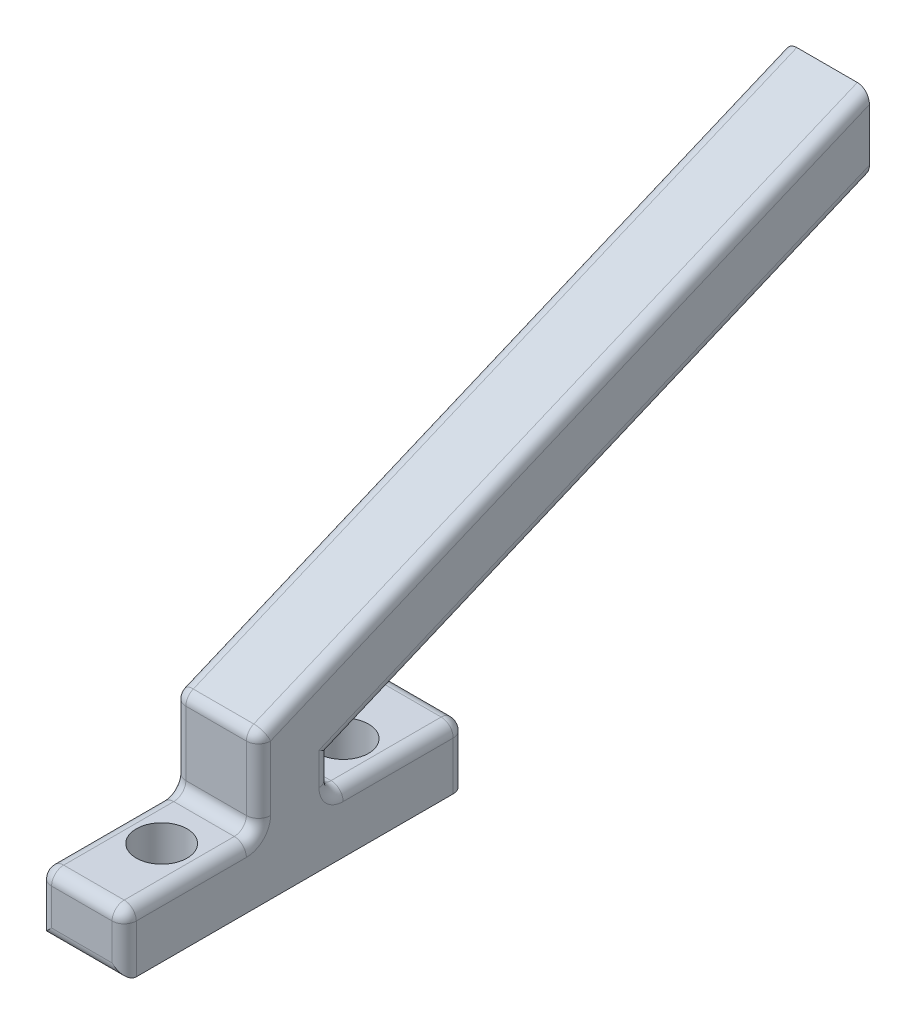
from build123d import *

# Parameters (mm, degrees)
BOSS_EXTRUDE1_DEPTH = 7
FILLET1_R           = 1
SKETCH2_R           = 2.1
CUT_EXTRUDE1_DEPTH  = 7


with BuildPart() as part:
    # Sketch1 → Boss-Extrude1 (new body)
    with BuildSketch(Plane.YZ):
        Polygon((0, 0), (-5, 0), (-5, 28.2), (0, 28.2), (0, 17.1), (6.992997501, 17.1), (27.73775651, -32.237200317), (28.226677629, -33.4), (21.717869147, -33.4), (3.007002499, 11.1), (0, 11.1), align=None)
    extrude(amount=BOSS_EXTRUDE1_DEPTH)

    # Fillet1
    fillet1_edges = [part.edges().sort_by_distance(p)[0] for p in [
        (0, 0, 5.55),
        (0, -2.5, 0),
        (0, -2.5, 28.2),
        (0, 0, 22.65),
        (0, 3.49649875, 17.1),
        (0, 17.609837565, -8.15),
        (0, 12.362435823, -11.15),
        (0, 1.50350125, 11.1),
        (7, 17.609837565, -8.15),
        (3.5, 0, 11.1),
        (3.5, 0, 0),
        (3.5, -5, 28.2),
        (3.5, 0, 28.2),
        (3.5, 0, 17.1),
        (3.5, 6.992997501, 17.1),
        (7, 3.49649875, 17.1),
        (7, 0, 22.65),
        (7, -2.5, 28.2),
        (7, -2.5, 0),
        (7, 0, 5.55),
        (7, 1.50350125, 11.1),
        (7, 12.362435823, -11.15),
    ]]
    fillet(fillet1_edges, radius=FILLET1_R)

    # Sketch2 → Cut-Extrude1 (cut)
    with BuildSketch(Plane.XZ.offset(5)):
        with Locations(Location((3.5, 21.6, 0), (0, 0, 270))):
            Circle(SKETCH2_R)
        with Locations(Location((3.5, 6.6, 0), (0, 0, 270))):
            Circle(SKETCH2_R)
    extrude(amount=-CUT_EXTRUDE1_DEPTH, mode=Mode.SUBTRACT)


solid = part.part
